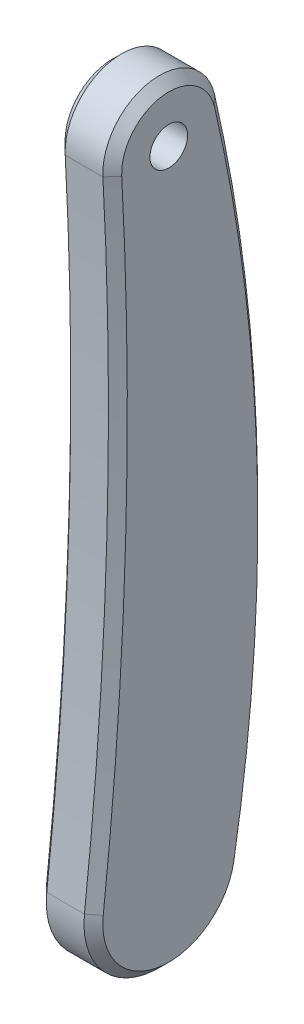
from build123d import *

# Parameters (mm, degrees)
BOSS_EXTRUDE1_DEPTH = 7.5
CHAMFER1_SIZE       = 2.5
SKETCH2_R           = 5
BOSS_EXTRUDE2_DEPTH = 10
SKETCH3_R           = 5
CUT_EXTRUDE1_DEPTH  = 10


with BuildPart() as part:
    # Sketch1 → Boss-Extrude1 (new, symmetric)
    with BuildSketch(Plane.YZ):
        with BuildLine():
            ThreePointArc((-82.746539792, 19.872642429), (-104.801791361, 2.808746854), (-88.361833105, -19.715427415))
            ThreePointArc((-88.361833105, -19.715427415), (0.256800738, -25.931146508), (88.369675456, -14.61660998))
            ThreePointArc((88.369675456, -14.61660998), (99.852333231, 2.099570811), (84.186105477, 14.977902914))
            ThreePointArc((84.186105477, 14.977902914), (0.617423728, 13.934366249), (-82.746539792, 19.872642429))
        make_face()
    extrude(amount=BOSS_EXTRUDE1_DEPTH, both=True)

    # Chamfer1
    chamfer1_edges = [part.edges().sort_by_distance(p)[0] for p in [
        (7.5, 0.256800738, -25.931146508),
        (7.5, 99.852333231, 2.099570811),
        (7.5, 0.617423728, 13.934366249),
        (-7.5, 99.852333231, 2.099570811),
        (-7.5, 0.256800738, -25.931146508),
        (-7.5, -104.801791361, 2.808746854),
        (-7.5, 0.617423728, 13.934366249),
        (7.5, -104.801791361, 2.808746854),
    ]]
    chamfer(chamfer1_edges, length=CHAMFER1_SIZE)

    # Sketch2 → Boss-Extrude2 (add)
    with BuildSketch(Plane(origin=(-7.5, 0, 0), x_dir=(0, -1, 0), z_dir=(-1, 0, 0))):
        with Locations(Location((85, 0, 0), (0, 0, 270))):
            Circle(SKETCH2_R)
    extrude(amount=BOSS_EXTRUDE2_DEPTH)

    # Sketch3 → Cut-Extrude1 (cut)
    with BuildSketch(Plane.YZ.offset(7.5)):
        with Locations(Location((85, 0, 0), (0, 0, 270))):
            Circle(SKETCH3_R)
    extrude(amount=-CUT_EXTRUDE1_DEPTH, mode=Mode.SUBTRACT)


solid = part.part
